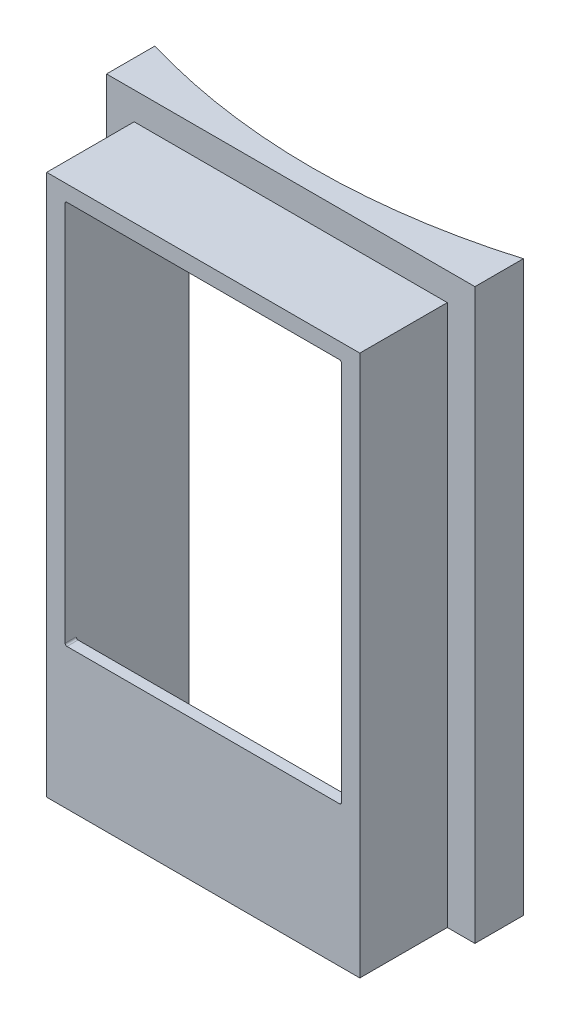
from build123d import *

# Parameters (mm, degrees)
SKETCH1_W           = 127
SKETCH1_H           = 196.088
EXTRUDE1_DEPTH      = 230.2002
SKETCH5_W           = 107.95
SKETCH5_H           = 186.563
EXTRUDE4_DEPTH      = 30.15234
EXTRUDE2_DEPTH      = 93.98
EXTRUDE2_DEPTH_BACK = 273.8502
SKETCH4_W           = 95.25
SKETCH4_H           = 132.588
SKETCH6_W           = 95.25
SKETCH6_H           = 45.974
SKETCH6_H_2         = 2.921
EXTRUDE5_DEPTH      = 256.54
FILLET1_R           = 2.54
SKETCH2_R           = 222.758
EXTRUDE3_DEPTH      = 202.86
FILLET2_R           = 0.635


with BuildPart() as part:
    # Sketch1 → Extrude1 (new body)
    with BuildSketch(Plane.XY):
        with Locations((0, -2.159)):
            Rectangle(SKETCH1_W, SKETCH1_H)
    extrude(amount=EXTRUDE1_DEPTH)

    # Sketch5 → Extrude4 (add)
    with BuildSketch(Plane.XY.offset(230.2002)):
        with Locations((0, -6.9215)):
            Rectangle(SKETCH5_W, SKETCH5_H)
    extrude(amount=EXTRUDE4_DEPTH)

    # Sketch4 → Extrude2 (cut, two sides: drawn at the far end of the back side and taken through both)
    with BuildSketch(Plane.XY.offset(230.2002).offset(-EXTRUDE2_DEPTH_BACK)):
        with Locations((0, 14.605)):
            Rectangle(SKETCH4_W, SKETCH4_H)
    extrude(amount=EXTRUDE2_DEPTH + EXTRUDE2_DEPTH_BACK, mode=Mode.SUBTRACT)

    # Sketch6 → Extrude5 (cut)
    with BuildSketch(Plane(origin=(0, 0, 0), x_dir=(-1, 0, 0), z_dir=(0, 0, -1))):
        with Locations((0, -74.676)):
            Rectangle(SKETCH6_W, SKETCH6_H)
        with Locations((0, 82.3595)):
            Rectangle(SKETCH6_W, SKETCH6_H_2)
    extrude(amount=-EXTRUDE5_DEPTH, mode=Mode.SUBTRACT)

    # Fillet1
    fillet1_edges = [part.edges().sort_by_distance(p)[0] for p in [
        (47.625, -97.663, 128.27),
        (-47.625, -97.663, 128.27),
        (47.625, 83.82, 128.27),
        (-47.625, 83.82, 128.27),
    ]]
    fillet(fillet1_edges, radius=FILLET1_R)

    # Sketch2 → Extrude3 (cut)
    with BuildSketch(Plane(origin=(0, 95.885, 0), x_dir=(-1, 0, 0), z_dir=(0, 1, 0))):
        Circle(SKETCH2_R)
    extrude(amount=-EXTRUDE3_DEPTH, mode=Mode.SUBTRACT)

    # Fillet2
    fillet2_edges = [part.edges().sort_by_distance(p)[0] for p in [
        (-47.625, 80.899, 258.44627),
        (-47.625, -51.689, 258.44627),
        (47.625, -51.689, 258.44627),
        (47.625, 80.899, 258.44627),
    ]]
    fillet(fillet2_edges, radius=FILLET2_R)


solid = part.part
